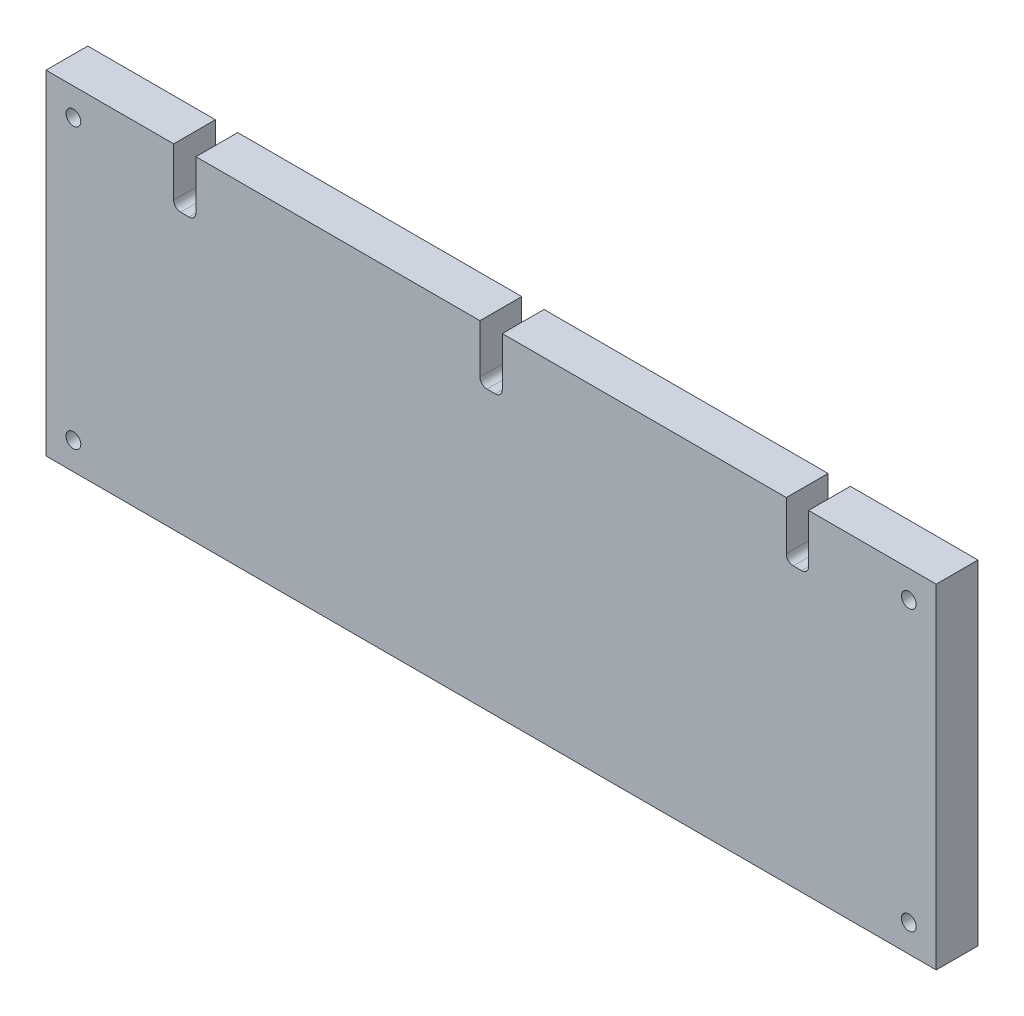
from build123d import *

# Parameters (mm, degrees)
SKETCH1_W           = 406
SKETCH1_H           = 152.4
SKETCH1_R           = 3.3655
BOSS_EXTRUDE1_DEPTH = 19.05
SKETCH2_R           = 3.3655
CUT_EXTRUDE1_DEPTH  = 21.082
CUT_EXTRUDE2_DEPTH  = 651.507426937
LPATTERN1_COUNT     = 2
LPATTERN1_PITCH     = 139.7
LPATTERN1_COL_COUNT = 2
LPATTERN1_COL_PITCH = 139.7


with BuildPart() as part:
    # Sketch1 → Boss-Extrude1 (new body)
    with BuildSketch(Plane.XY):
        with Locations((-432, 63.7)):
            Rectangle(SKETCH1_W, SKETCH1_H)
        with Locations(Location((-241.5, 0, 0), (0, 0, 180))):
            Circle(SKETCH1_R, mode=Mode.SUBTRACT)
        with Locations(Location((-622.5, 0, 0), (0, 0, 180))):
            Circle(SKETCH1_R, mode=Mode.SUBTRACT)
    extrude(amount=BOSS_EXTRUDE1_DEPTH)

    # Sketch2 → Cut-Extrude1 (cut)
    with BuildSketch(Plane(origin=(-432, 23.6125, -2.032), x_dir=(-1, 0, 0), z_dir=(0, 0, -1))):
        with Locations((-190.5032, 103.7907)):
            Circle(SKETCH2_R)
    cut_extrude1 = extrude(amount=-CUT_EXTRUDE1_DEPTH, mode=Mode.SUBTRACT)

    # Mirror1: Cut-Extrude1 across plane
    add(cut_extrude1.mirror(Plane.ZY.offset(432)), mode=Mode.SUBTRACT)

    # Sketch4 → Cut-Extrude2 (cut, through all)
    with BuildSketch(Plane.XY.offset(19.05)):
        with BuildLine():
            Line((-433.905, 114.5), (-430.095, 114.5))
            ThreePointArc((-430.095, 114.5), (-427.84993597, 115.42993597), (-426.92, 117.675))
            Line((-426.92, 117.675), (-426.92, 139.9))
            Line((-426.92, 139.9), (-437.08, 139.9))
            Line((-437.08, 139.9), (-437.08, 117.675))
            ThreePointArc((-437.08, 117.675), (-436.15006403, 115.42993597), (-433.905, 114.5))
        make_face()
    cut_extrude2 = extrude(amount=-CUT_EXTRUDE2_DEPTH, mode=Mode.SUBTRACT)

    # LPattern1: Cut-Extrude2 ×2
    with Locations(*[(i * LPATTERN1_PITCH, 0, 0) for i in range(1, LPATTERN1_COUNT)]):
        add(cut_extrude2, mode=Mode.SUBTRACT)

    # LPattern1 col: Cut-Extrude2 ×2
    with Locations(*[(-i * LPATTERN1_COL_PITCH, 0, 0) for i in range(1, LPATTERN1_COL_COUNT)]):
        add(cut_extrude2, mode=Mode.SUBTRACT)


solid = part.part
